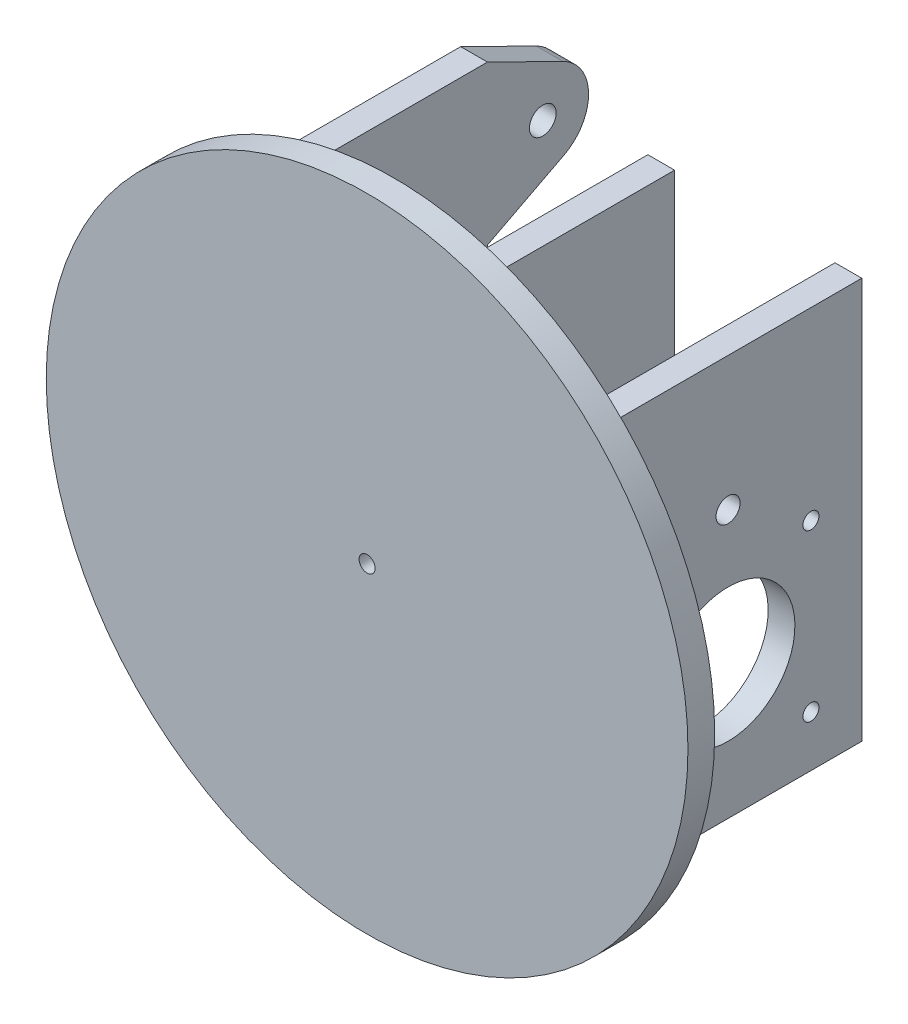
from build123d import *

# Parameters (mm, degrees)
SKETCH1_R               = 60
SKETCH1_R_2             = 1.5
BOSS_EXTRUDE1_DEPTH     = 5
SKETCH2_W               = 5
SKETCH2_H               = 75
BOSS_EXTRUDE2_DEPTH     = 50
SKETCH3_R               = 1.5
SKETCH3_R_2             = 12.5
CUT_EXTRUDE1_DEPTH      = 122.063000128
CUT_EXTRUDE4_DEPTH      = 101.031245119
CUT_EXTRUDE4_DEPTH_BACK = 53
SKETCH5_R               = 2.24506403
SKETCH6_R               = 1.5
SKETCH6_R_2             = 12.5
CUT_EXTRUDE5_DEPTH      = 5
SKETCH7_R               = 2.5
BOSS_EXTRUDE4_DEPTH     = 5


with BuildPart() as part:
    # Sketch1 → Boss-Extrude1 (new body)
    with BuildSketch(Plane.XY):
        Circle(SKETCH1_R)
        Circle(SKETCH1_R_2, mode=Mode.SUBTRACT)
    extrude(amount=BOSS_EXTRUDE1_DEPTH)

    # Sketch2 → Boss-Extrude2 (add)
    with BuildSketch(Plane(origin=(0, 0, 0), x_dir=(-1, 0, 0), z_dir=(0, 0, -1))):
        with Locations((-35, 0)):
            Rectangle(SKETCH2_W, SKETCH2_H)
        with Locations((35, 0)):
            Rectangle(SKETCH2_W, SKETCH2_H)
        Rectangle(SKETCH2_W, SKETCH2_H)
    extrude(amount=BOSS_EXTRUDE2_DEPTH)

    # Sketch3 → Cut-Extrude1 (cut, through all)
    with BuildSketch(Plane.ZY.offset(-32.5)):
        with Locations(Location((-40.5, 3, 0), (0, 0, 270))):
            Circle(SKETCH3_R)
        with Locations(Location((-9.5, 3, 0), (0, 0, 270))):
            Circle(SKETCH3_R)
        with Locations(Location((-9.5, -28, 0), (0, 0, 270))):
            Circle(SKETCH3_R)
        with Locations(Location((-40.5, -28, 0), (0, 0, 270))):
            Circle(SKETCH3_R)
        with Locations(Location((-25, -12.5, 0), (0, 0, 270))):
            Circle(SKETCH3_R_2)
    extrude(amount=-CUT_EXTRUDE1_DEPTH, mode=Mode.SUBTRACT)

    # Sketch5 → Cut-Extrude4 (cut, two sides: drawn at the far end of the back side and taken through both)
    with BuildSketch(Plane.ZY.offset(2.5).offset(-CUT_EXTRUDE4_DEPTH_BACK)):
        with Locations(Location((-25, 12.5, 0), (0, 0, 180))):
            Circle(SKETCH5_R)
    extrude(amount=CUT_EXTRUDE4_DEPTH + CUT_EXTRUDE4_DEPTH_BACK, mode=Mode.SUBTRACT)

    # Sketch6 → Cut-Extrude5 (cut)
    with BuildSketch(Plane.ZY.offset(37.5)):
        with Locations(Location((-40.5, 3, 0), (0, 0, 270))):
            Circle(SKETCH6_R)
        with Locations(Location((-9.5, 3, 0), (0, 0, 270))):
            Circle(SKETCH6_R)
        with Locations(Location((-9.5, -28, 0), (0, 0, 270))):
            Circle(SKETCH6_R)
        with Locations(Location((-40.5, -28, 0), (0, 0, 270))):
            Circle(SKETCH6_R)
        with Locations(Location((-25, -12.5, 0), (0, 0, 270))):
            Circle(SKETCH6_R_2)
    extrude(amount=-CUT_EXTRUDE5_DEPTH, mode=Mode.SUBTRACT)

    # Sketch7 → Boss-Extrude4 (add)
    with BuildSketch(Plane.ZY.offset(37.5)):
        with BuildLine():
            Line((-50, 37.5), (-64.138546099, 30.534707883))
            ThreePointArc((-64.138546099, 30.534707883), (-68.91560159, 22.940582469), (-64.290723579, 15.252832254))
            Line((-64.290723579, 15.252832254), (-50, 7.855339059))
            Line((-50, 7.855339059), (-50, 37.5))
        make_face()
        with Locations(Location((-60.355339059, 22.855339059, 0), (0, 0, 270))):
            Circle(SKETCH7_R, mode=Mode.SUBTRACT)
    extrude(amount=-BOSS_EXTRUDE4_DEPTH)


solid = part.part
